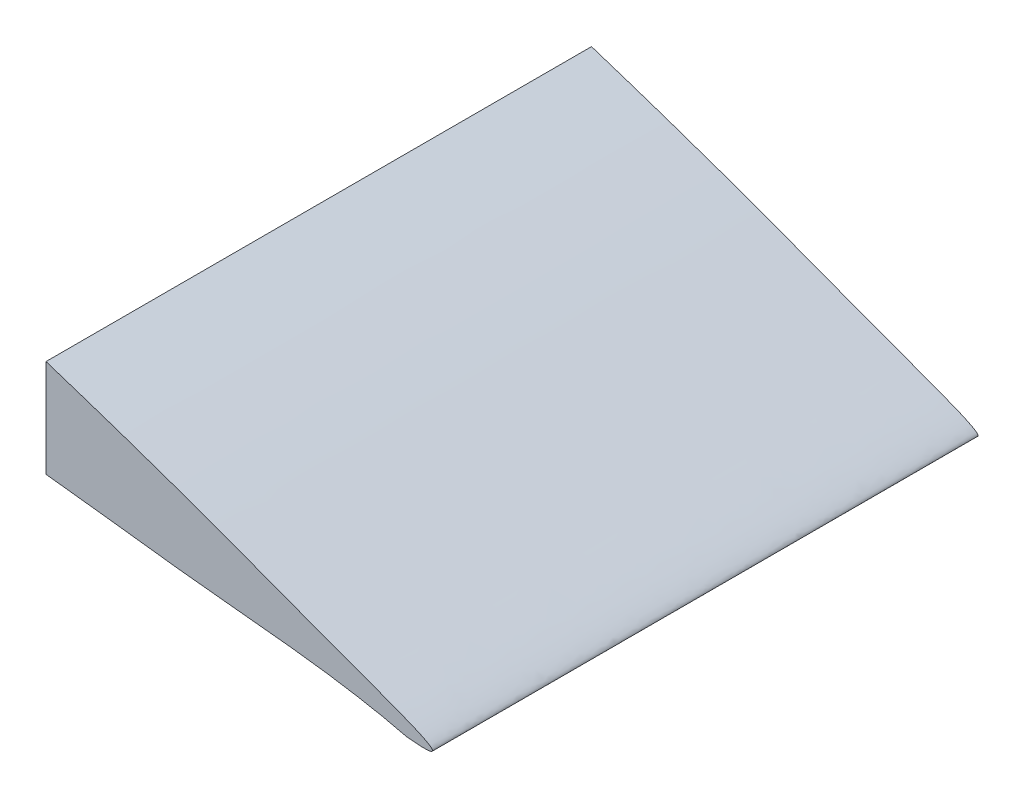
from build123d import *

# Parameters (mm, degrees)
BOSS_EXTRUDE1_DEPTH = 46.0375
SKETCH2_R           = 6.35
SKETCH2_R_2         = 3.175
CUT_EXTRUDE1_DEPTH  = 320.066790275
SKETCH4_W           = 288.963808296
SKETCH4_H           = 117.489254048
CUT_EXTRUDE3_DEPTH  = 320.066790275


with BuildPart() as part:
    # Sketch1 → Boss-Extrude1 (new body)
    with BuildSketch(Plane.XY):
        with BuildLine():
            add(Edge.make_bspline(
                [(0.000560351, 0.000130087), (0.810633127, 7.359196055), (8.649092025, 17.856605174), (26.286719818, 29.975176328), (52.111128271, 42.069215275), (89.597618475, 49.290763054), (131.400792109, 47.884831915), (173.256699242, 40.041104278), (217.961060472, 29.612974894), (256.952064401, 19.528920948), (290.35983767, 8.71099439), (301.273197721, 4.382828139), (314.816918223, -0.516206742), (309.846313895, 0.000130087)],
                knots=[0, 0, 0, 0, 0.060863618, 0.113688265, 0.188608742, 0.312908923, 0.448482434, 0.557612135, 0.691544113, 0.852438279, 0.92975597, 0.976058229, 1, 1, 1, 1], degree=3))
            add(Edge.make_bspline(
                [(309.846313895, 0.000130087), (303.956832565, 1.47095521), (293.989507544, 2.093987313), (276.26402299, 4.514356704), (260.846344817, 5.427413394), (235.858814759, 7.870306192), (205.101424636, 8.838080282), (157.718638092, 9.030650149), (110.497331172, 6.181495223), (66.506197185, -0.586669107), (36.454672816, -6.098499901), (15.316603331, -6.189065841), (1.230714189, -6.924076091), (0.000560351, 0.000130087)],
                knots=[0, 0, 0, 0, 0.057787081, 0.095274891, 0.171021118, 0.205339302, 0.335319146, 0.464904334, 0.658702312, 0.785511947, 0.893517288, 0.94309214, 1, 1, 1, 1], degree=3))
        make_face()
    extrude(amount=BOSS_EXTRUDE1_DEPTH)

    # Sketch2 → Cut-Extrude1 (cut, through all)
    with BuildSketch(Plane.XY.offset(46.0375)):
        with Locations((20.32, 10.16)):
            Circle(SKETCH2_R)
        with Locations((227.296313895, 19.050130087)):
            Circle(SKETCH2_R_2)
    extrude(amount=-CUT_EXTRUDE1_DEPTH, mode=Mode.SUBTRACT)

    # Sketch4 → Cut-Extrude3 (cut, through all)
    with BuildSketch(Plane.XY.offset(46.0375)):
        with Locations((134.918656203, 34.528076629)):
            Rectangle(SKETCH4_W, SKETCH4_H)
    extrude(amount=-CUT_EXTRUDE3_DEPTH, mode=Mode.SUBTRACT)


solid = part.part
